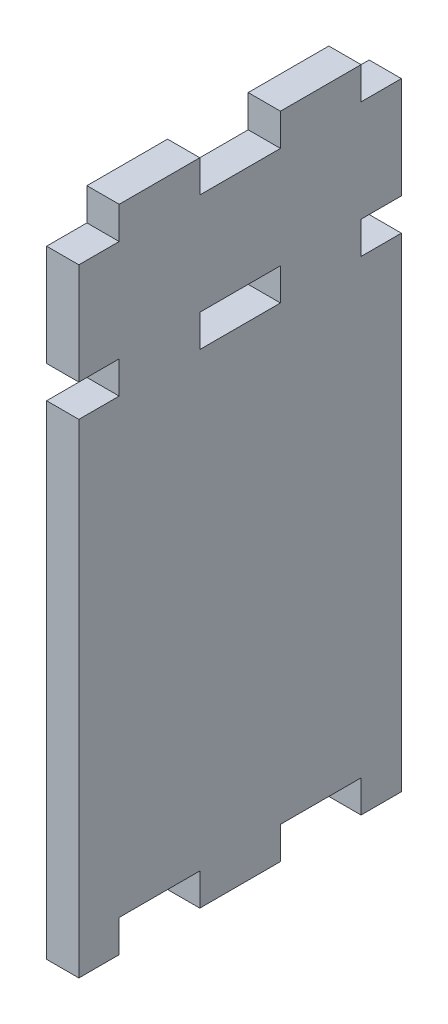
from build123d import *

# Parameters (mm, degrees)
BOSS_EXTRUDE1_DEPTH = 2
BOSS_EXTRUDE2_DEPTH = 2


with BuildPart() as part:
    # Sketch1 → Boss-Extrude1 (new body)
    with BuildSketch(Plane(origin=(0, 0, 0), x_dir=(0, 0, -1), z_dir=(1, 0, 0))):
        Polygon((-7.5, 3.15), (-7.5, 5.15), (-2.5, 5.15), (-2.5, 3.15), (2.5, 3.15), (2.5, 5.15), (7.5, 5.15), (7.5, 3.15), (10, 3.15), (10, -3.15), (7.5, -3.15), (7.5, -5.15), (2.5, -5.15), (2.5, -3.15), (-2.5, -3.15), (-2.5, -5.15), (-7.5, -5.15), (-7.5, -3.15), (-10, -3.15), (-10, 3.15), align=None)
    extrude(amount=BOSS_EXTRUDE1_DEPTH)

    # Sketch2 → Boss-Extrude2 (add)
    with BuildSketch(Plane(origin=(2, 0, 0), x_dir=(0, 0, -1), z_dir=(1, 0, 0))):
        Polygon((-10, -5.15), (10, -5.15), (10, -35.15), (7.5, -35.15), (7.5, -33.15), (2.5, -33.15), (2.5, -35.15), (-2.5, -35.15), (-2.5, -33.15), (-7.5, -33.15), (-7.5, -35.15), (-10, -35.15), align=None)
    extrude(amount=-BOSS_EXTRUDE2_DEPTH)


solid = part.part
